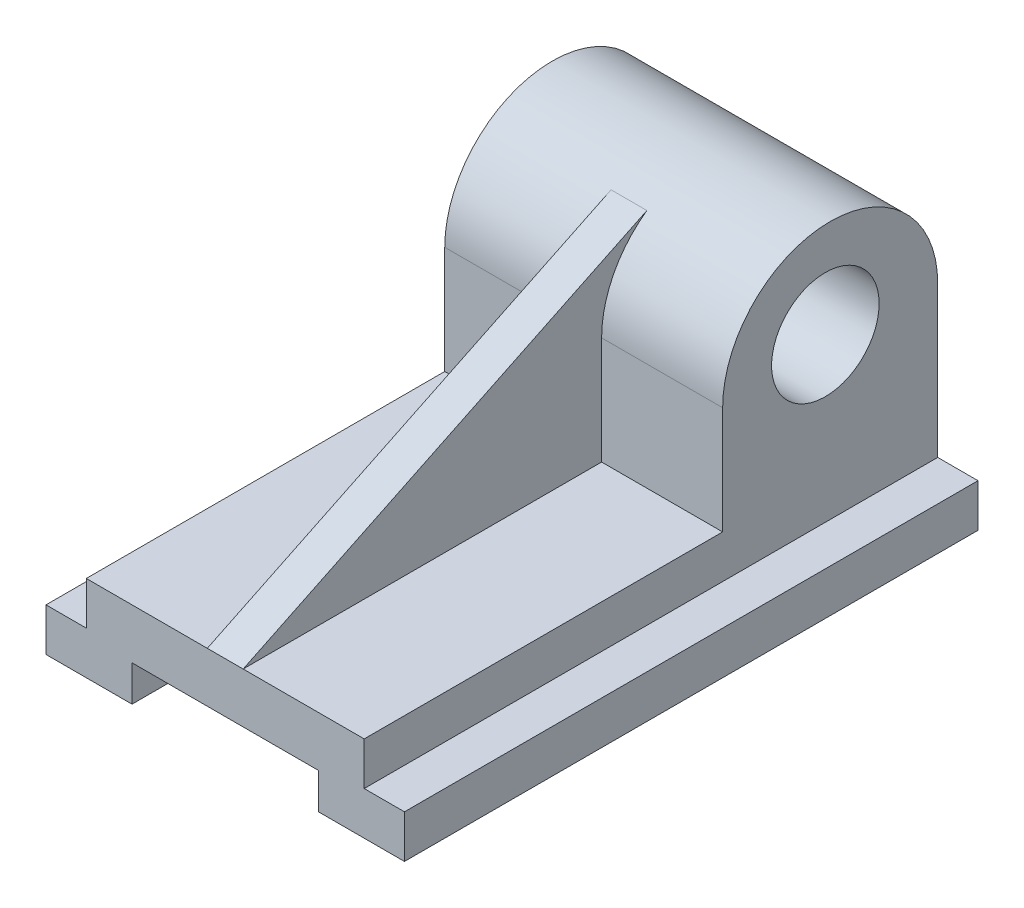
from build123d import *

# Parameters (mm, degrees)
SKETCH1_W           = 100
SKETCH1_H           = 24
BOSS_EXTRUDE1_DEPTH = 160
SKETCH2_W           = 52
SKETCH2_H           = 10
CUT_EXTRUDE1_DEPTH  = 169.059513268
SKETCH3_W           = 12
SKETCH3_H           = 12
CUT_EXTRUDE2_DEPTH  = 169.059513268
SKETCH4_W           = 77.52732848
SKETCH4_H           = 60
BOSS_EXTRUDE2_DEPTH = 60
FILLET1_RADIUS      = 30
FILLET1_LENGTH      = 77.52732848
SKETCH6_R           = 15
CUT_EXTRUDE3_DEPTH  = 197.629062169
RIB1_REACH          = 184.439
SKETCH7_WALL_W      = 501.963544736
SKETCH7_WALL_H      = 10


with BuildPart() as part:
    # Sketch1 → Boss-Extrude1 (new body)
    with BuildSketch(Plane.XY):
        Rectangle(SKETCH1_W, SKETCH1_H)
    extrude(amount=BOSS_EXTRUDE1_DEPTH)

    # Sketch2 → Cut-Extrude1 (cut, through all)
    with BuildSketch(Plane.XY.offset(160)):
        with Locations((0, -7)):
            Rectangle(SKETCH2_W, SKETCH2_H)
    extrude(amount=-CUT_EXTRUDE1_DEPTH, mode=Mode.SUBTRACT)

    # Sketch3 → Cut-Extrude2 (cut, through all)
    with BuildSketch(Plane.XY.offset(160)):
        with Locations((44.76366424, 6)):
            Rectangle(SKETCH3_W, SKETCH3_H)
    cut_extrude2 = extrude(amount=-CUT_EXTRUDE2_DEPTH, mode=Mode.SUBTRACT)

    # Mirror1: Cut-Extrude2 across plane
    add(cut_extrude2.mirror(Plane(origin=(0, 0, 0), x_dir=(0, 0, 1), z_dir=(1, 0, 0))), mode=Mode.SUBTRACT)

    # Sketch4 → Boss-Extrude2 (add)
    with BuildSketch(Plane(origin=(0, 12, 0), x_dir=(1, 0, 0), z_dir=(0, 1, 0))):
        with Locations((0, -30)):
            Rectangle(SKETCH4_W, SKETCH4_H)
    extrude(amount=BOSS_EXTRUDE2_DEPTH)

    # Fillet1: full round fillet: the end face becomes a half cylinder, R = half its width
    fillet1_face = Plane((0, 72, 30), x_dir=(1, 0, 0), z_dir=(0, 1, 0))  # on the end face: x along it, z out of the body
    fillet1_slab = fillet1_face.offset(-FILLET1_RADIUS / 2) * Box(FILLET1_LENGTH, 2 * FILLET1_RADIUS, FILLET1_RADIUS, mode=Mode.PRIVATE)  # the body's end, R deep
    fillet1_round = Plane((0, 42, 30), x_dir=(0, 1, 0), z_dir=(1, 0, 0)) * Cylinder(FILLET1_RADIUS, FILLET1_LENGTH, mode=Mode.PRIVATE)  # its axis R under the face
    add(fillet1_slab - fillet1_round, mode=Mode.SUBTRACT)

    # Sketch6 → Cut-Extrude3 (cut, through all)
    with BuildSketch(Plane(origin=(38.76366424, 0, 0), x_dir=(0, 0, -1), z_dir=(1, 0, 0))):
        with Locations((-31.347642199, 45.351147576)):
            Circle(SKETCH6_R)
    extrude(amount=-CUT_EXTRUDE3_DEPTH, mode=Mode.SUBTRACT)

    # Sketch7 wall → Rib1 (add, up to next)
    with BuildSketch(Plane(origin=(0, 41.402146272, 99.192634344), x_dir=(0, 0.435311709867, -0.900279798314), z_dir=(0, 0.900279798314, 0.435311709867)), mode=Mode.PRIVATE) as rib1_sk1:
        Rectangle(SKETCH7_WALL_W, SKETCH7_WALL_H)
    rib1_tool1 = extrude(rib1_sk1.sketch, amount=-RIB1_REACH, mode=Mode.PRIVATE) - part.part
    add(rib1_tool1.solids().sort_by_distance((0, 41.402146272, 99.192634344))[0])


solid = part.part
